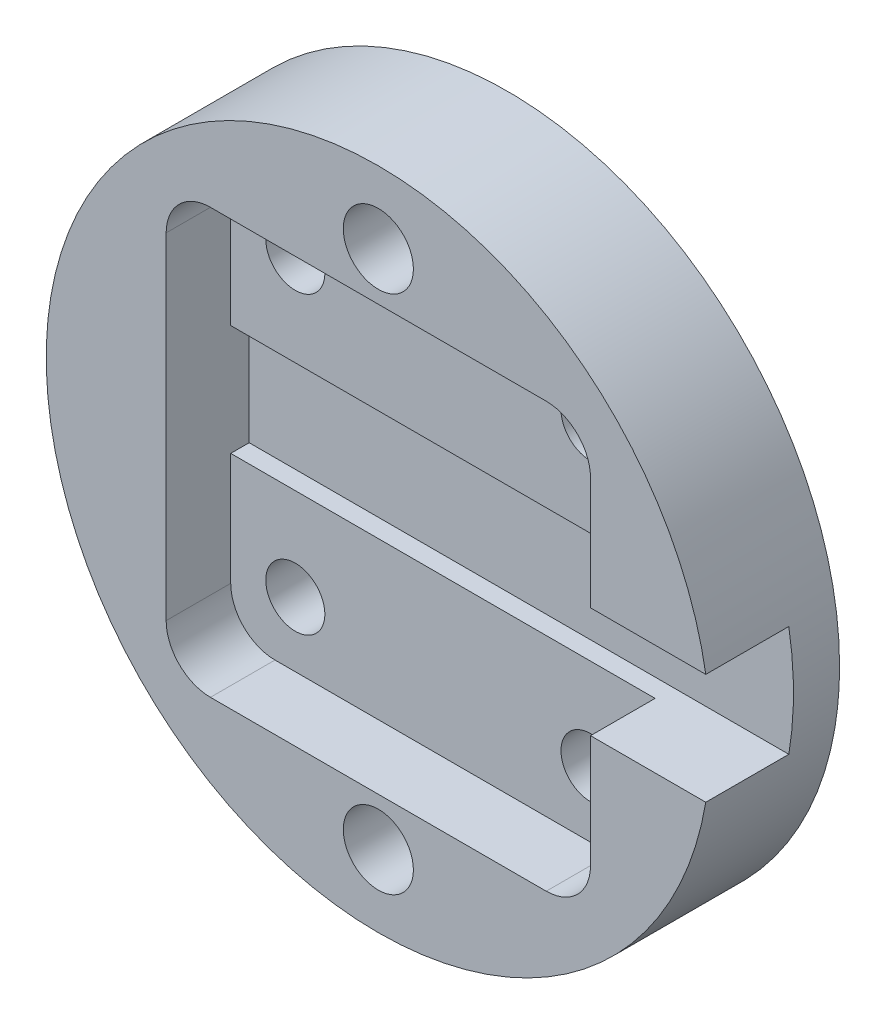
from build123d import *

# Parameters (mm, degrees)
SKETCH1_R           = 18
SKETCH1_R_2         = 1.9
BOSS_EXTRUDE1_DEPTH = 7
CUT_EXTRUDE1_START  = 7
SKETCH1_3_W         = 23
SKETCH1_3_H         = 23
SKETCH1_3_R         = 1.6
CUT_EXTRUDE1_DEPTH  = 3.5
SKETCH1_4_R         = 1.6
CUT_EXTRUDE3_DEPTH  = 27.400757565
CUT_EXTRUDE4_START  = -4.5
CUT_EXTRUDE4_DEPTH  = 4.5
FILLET1_R           = 2.4


with BuildPart() as part:
    # Sketch1 → Boss-Extrude1 (new body)
    with BuildSketch(Plane(origin=(0, 0, 0), x_dir=(0, 1, 0), z_dir=(0, 0, 1))):
        with Locations(Location((0, 0, 0), (0, 0, 270))):
            Circle(SKETCH1_R)
        with Locations(Location((14.1, 0, 0), (0, 0, 270))):
            Circle(SKETCH1_R_2, mode=Mode.SUBTRACT)
        with Locations(Location((-14.1, 0, 0), (0, 0, 270))):
            Circle(SKETCH1_R_2, mode=Mode.SUBTRACT)
    extrude(amount=BOSS_EXTRUDE1_DEPTH)

    # Sketch1<3> → Cut-Extrude1 (cut)
    # profile 1 of 5: a face of its own
    with BuildSketch(Plane(origin=(0, 0, 0), x_dir=(0, 1, 0), z_dir=(0, 0, 1)).offset(CUT_EXTRUDE1_START)):
        Rectangle(SKETCH1_3_W, SKETCH1_3_H)
        with Locations((-8, -8)):
            Circle(SKETCH1_3_R, mode=Mode.SUBTRACT)
        with Locations((8, -8)):
            Circle(SKETCH1_3_R, mode=Mode.SUBTRACT)
        with Locations((8, 8)):
            Circle(SKETCH1_3_R, mode=Mode.SUBTRACT)
        with Locations((-8, 8)):
            Circle(SKETCH1_3_R, mode=Mode.SUBTRACT)
    # profile 2 of 5: a face of its own
    with BuildSketch(Plane(origin=(0, 0, 0), x_dir=(0, 1, 0), z_dir=(0, 0, 1)).offset(CUT_EXTRUDE1_START)):
        with Locations((-8, 8)):
            Circle(SKETCH1_3_R)
    # profile 3 of 5: a face of its own
    with BuildSketch(Plane(origin=(0, 0, 0), x_dir=(0, 1, 0), z_dir=(0, 0, 1)).offset(CUT_EXTRUDE1_START)):
        with Locations((8, 8)):
            Circle(SKETCH1_3_R)
    # profile 4 of 5: a face of its own
    with BuildSketch(Plane(origin=(0, 0, 0), x_dir=(0, 1, 0), z_dir=(0, 0, 1)).offset(CUT_EXTRUDE1_START)):
        with Locations((-8, -8)):
            Circle(SKETCH1_3_R)
    # profile 5 of 5: a face of its own
    with BuildSketch(Plane(origin=(0, 0, 0), x_dir=(0, 1, 0), z_dir=(0, 0, 1)).offset(CUT_EXTRUDE1_START)):
        with Locations((8, -8)):
            Circle(SKETCH1_3_R)
    extrude(amount=-CUT_EXTRUDE1_DEPTH, mode=Mode.SUBTRACT)

    # Sketch1<4> → Cut-Extrude3 (cut, through all)
    with BuildSketch(Plane(origin=(0, 0, 0), x_dir=(0, 1, 0), z_dir=(0, 0, 1))):
        with Locations(Location((-8, -8, 0), (0, 0, 90))):
            Circle(SKETCH1_4_R)
        with Locations(Location((8, -8, 0), (0, 0, 90))):
            Circle(SKETCH1_4_R)
        with Locations(Location((8, 8, 0), (0, 0, 90))):
            Circle(SKETCH1_4_R)
        with Locations(Location((-8, 8, 0), (0, 0, 90))):
            Circle(SKETCH1_4_R)
    extrude(amount=CUT_EXTRUDE3_DEPTH, mode=Mode.SUBTRACT)

    # Sketch2 → Cut-Extrude4 (cut)
    with BuildSketch(Plane.XY.offset(7).offset(CUT_EXTRUDE4_START)):
        with BuildLine():
            Line((-11.5, 3), (17.748239349, 3))
            ThreePointArc((17.748239349, 3), (18, 0), (17.748239349, -3))
            Line((17.748239349, -3), (-11.5, -3))
            Line((-11.5, -3), (-11.5, 3))
        make_face()
    extrude(amount=CUT_EXTRUDE4_DEPTH, mode=Mode.SUBTRACT)

    # Fillet1
    fillet1_edges = [part.edges().sort_by_distance(p)[0] for p in [
        (11.5, -11.5, 5.25),
        (-11.5, -11.5, 5.25),
        (-11.5, 11.5, 5.25),
        (11.5, 11.5, 5.25),
    ]]
    fillet(fillet1_edges, radius=FILLET1_R)


solid = part.part
